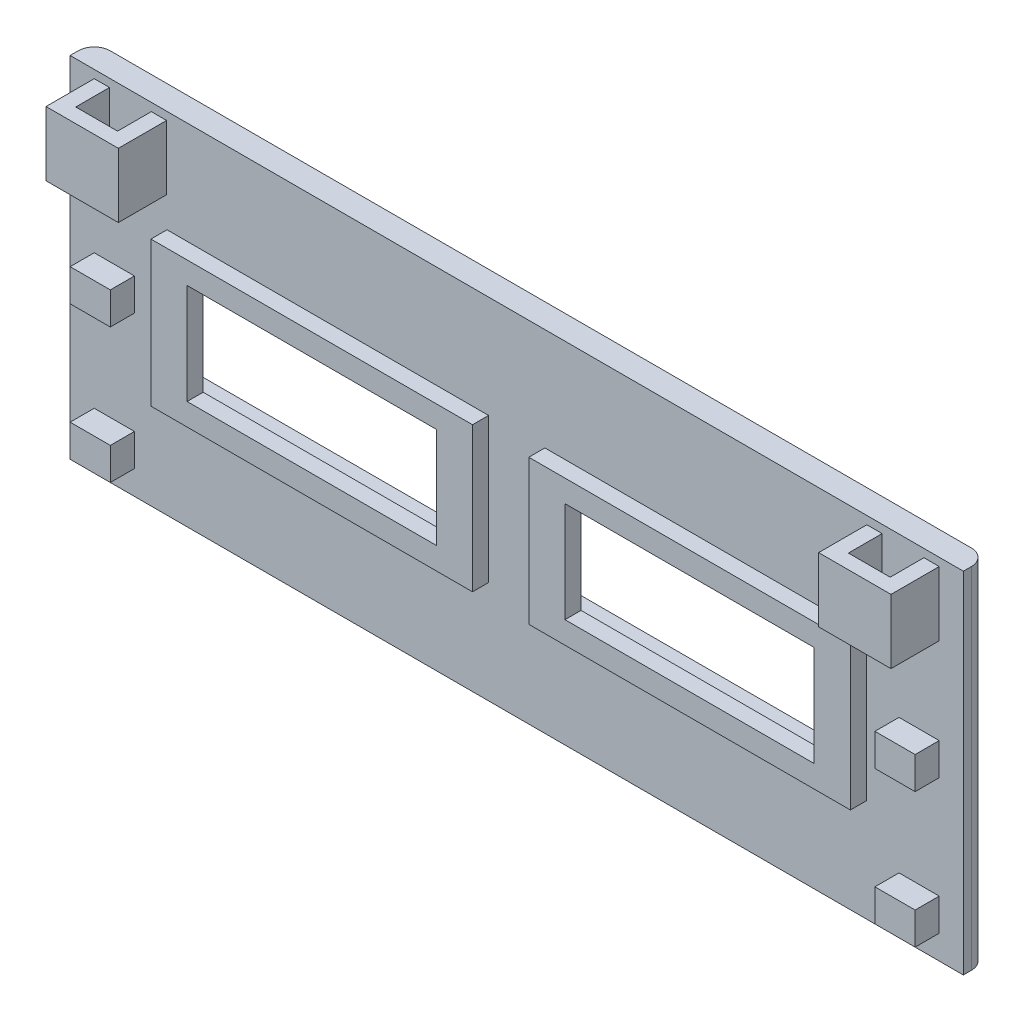
from build123d import *

# Parameters (mm, degrees)
SKETCH1_W           = 111.1
SKETCH1_H           = 51.3
BOSS_EXTRUDE1_DEPTH = 3
SKETCH2_W           = 111.1
SKETCH2_H           = 51.3
SKETCH2_W_2         = 105.3
SKETCH2_H_2         = 45.3
BOSS_EXTRUDE2_DEPTH = 40.5
SKETCH10_W          = 126.244554882
SKETCH10_H          = 68.697179438
CUT_EXTRUDE2_DEPTH  = 53
SKETCH11_W          = 5
SKETCH11_H          = 4
BOSS_EXTRUDE7_DEPTH = 3
SKETCH12_W          = 9
SKETCH12_H          = 8
BOSS_EXTRUDE8_DEPTH = 6
SKETCH13_W          = 5.2
SKETCH13_H          = 4.2
CUT_EXTRUDE3_DEPTH  = 12
FILLET2_R           = 2
SKETCH5_W           = 37
SKETCH5_H           = 15.3
CUT_EXTRUDE5_DEPTH  = 3
SKETCH15_W          = 40
SKETCH15_H          = 18
SKETCH15_W_2        = 31
SKETCH15_H_2        = 12.5
BOSS_EXTRUDE9_DEPTH = 2


with BuildPart() as part:
    # Sketch1 → Boss-Extrude1 (new body)
    with BuildSketch(Plane(origin=(0, 0, 0), x_dir=(1, 0, 0), z_dir=(0, 1, 0))):
        Rectangle(SKETCH1_W, SKETCH1_H)
    extrude(amount=BOSS_EXTRUDE1_DEPTH)

    # Sketch2 → Boss-Extrude2 (add)
    with BuildSketch(Plane(origin=(0, 3, 0), x_dir=(1, 0, 0), z_dir=(0, 1, 0))):
        Rectangle(SKETCH2_W, SKETCH2_H)
        Rectangle(SKETCH2_W_2, SKETCH2_H_2, mode=Mode.SUBTRACT)
    extrude(amount=BOSS_EXTRUDE2_DEPTH)

    # Sketch10 → Cut-Extrude2 (cut)
    with BuildSketch(Plane.XY.offset(-22.65)):
        with Locations((0, 21.75)):
            Rectangle(SKETCH10_W, SKETCH10_H)
    extrude(amount=CUT_EXTRUDE2_DEPTH, mode=Mode.SUBTRACT)

    # Sketch11 → Boss-Extrude7 (add)
    with BuildSketch(Plane.XY.offset(-22.65)):
        with Locations((-50.05, 21.75)):
            Rectangle(SKETCH11_W, SKETCH11_H)
        with Locations((-50.05, 5)):
            Rectangle(SKETCH11_W, SKETCH11_H)
        with Locations((50.05, 5)):
            Rectangle(SKETCH11_W, SKETCH11_H)
        with Locations((50.05, 21.75)):
            Rectangle(SKETCH11_W, SKETCH11_H)
    extrude(amount=BOSS_EXTRUDE7_DEPTH)

    # Sketch12 → Boss-Extrude8 (add)
    with BuildSketch(Plane.XY.offset(-22.65)):
        with Locations((-48.05, 38.5)):
            Rectangle(SKETCH12_W, SKETCH12_H)
        with Locations((48.05, 38.5)):
            Rectangle(SKETCH12_W, SKETCH12_H)
    extrude(amount=BOSS_EXTRUDE8_DEPTH)

    # Sketch13 → Cut-Extrude3 (cut)
    with BuildSketch(Plane(origin=(0, 42.5, 0), x_dir=(1, 0, 0), z_dir=(0, 1, 0))):
        with Locations((-48.05, 20.55)):
            Rectangle(SKETCH13_W, SKETCH13_H)
        with Locations((48.05, 20.55)):
            Rectangle(SKETCH13_W, SKETCH13_H)
    extrude(amount=-CUT_EXTRUDE3_DEPTH, mode=Mode.SUBTRACT)

    # Fillet2
    fillet2_edges = [part.edges().sort_by_distance(p)[0] for p in [
        (-55.55, 21.75, -25.65),
        (55.55, 21.75, -25.65),
    ]]
    fillet(fillet2_edges, radius=FILLET2_R)

    # Sketch5 → Cut-Extrude5 (cut)
    with BuildSketch(Plane(origin=(0, 0, -25.65), x_dir=(-1, 0, 0), z_dir=(0, 0, -1))):
        with Locations((23.5, 21.75)):
            Rectangle(SKETCH5_W, SKETCH5_H)
        with Locations((-23.5, 21.75)):
            Rectangle(SKETCH5_W, SKETCH5_H)
    extrude(amount=-CUT_EXTRUDE5_DEPTH, mode=Mode.SUBTRACT)

    # Sketch15 → Boss-Extrude9 (add)
    # profile 1 of 2: a face of its own
    with BuildSketch(Plane.XY.offset(-22.65)):
        with Locations((23.5, 21.75)):
            Rectangle(SKETCH15_W, SKETCH15_H)
        with Locations((23.5, 21.75)):
            Rectangle(SKETCH15_W_2, SKETCH15_H_2, mode=Mode.SUBTRACT)
    # profile 2 of 2: a face of its own
    with BuildSketch(Plane.XY.offset(-22.65)):
        with Locations((-23.5, 21.75)):
            Rectangle(SKETCH15_W, SKETCH15_H)
        with Locations((-23.5, 21.75)):
            Rectangle(SKETCH15_W_2, SKETCH15_H_2, mode=Mode.SUBTRACT)
    extrude(amount=BOSS_EXTRUDE9_DEPTH)


solid = part.part
